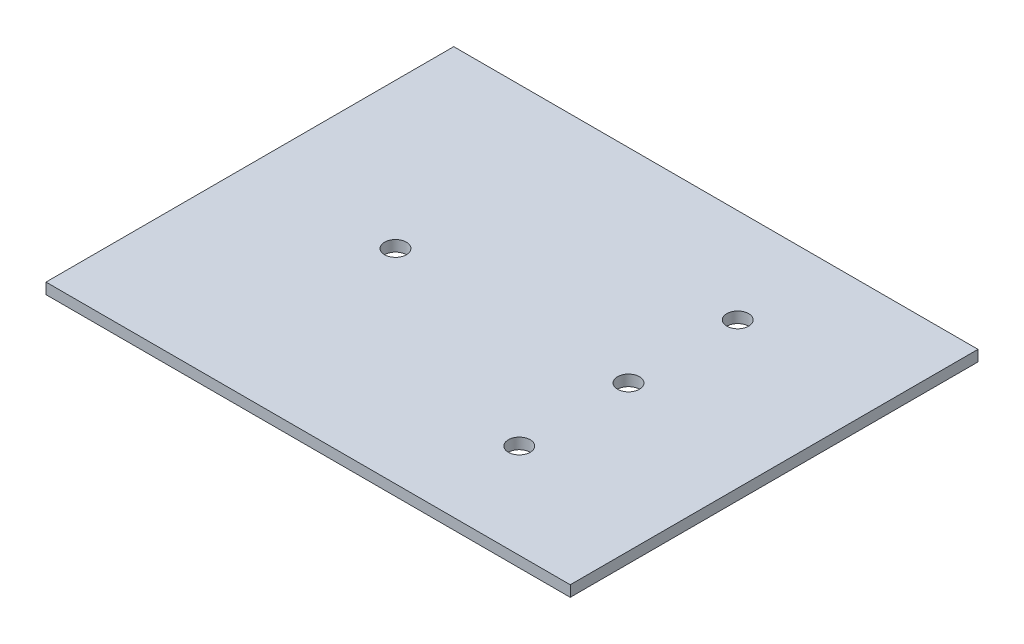
from build123d import *

# Parameters (mm, degrees)
BOSS_EXTRUDE1_DEPTH = 9.525
BOSS_EXTRUDE2_DEPTH = 9.525
SKETCH4_W           = 63.5
SKETCH4_H           = 355.6
BOSS_EXTRUDE3_DEPTH = 9.525
SKETCH5_R           = 9.525
CUT_EXTRUDE1_DEPTH  = 648.271856043


with BuildPart() as part:
    # Sketch1 → Boss-Extrude1 (new body)
    with BuildSketch(Plane(origin=(0, 0, 0), x_dir=(1, 0, 0), z_dir=(0, 1, 0))):
        Polygon((461.512355724, 17.636671785), (558.8, 99.270698215), (558.8, 177.8), (228.6, 177.8), (228.6, -177.8), align=None)
    extrude(amount=BOSS_EXTRUDE1_DEPTH)

    # Sketch1<4> → Boss-Extrude2 (add)
    with BuildSketch(Plane(origin=(0, 0, 0), x_dir=(1, 0, 0), z_dir=(0, 1, 0))):
        Polygon((558.8, -177.8), (558.8, 99.270698215), (461.512355724, 17.636671785), (228.6, -177.8), align=None)
    extrude(amount=BOSS_EXTRUDE2_DEPTH)

    # Sketch4 → Boss-Extrude3 (add)
    with BuildSketch(Plane.XZ):
        with Locations((590.55, 0)):
            Rectangle(SKETCH4_W, SKETCH4_H)
        with Locations((196.85, 0)):
            Rectangle(SKETCH4_W, SKETCH4_H)
    extrude(amount=-BOSS_EXTRUDE3_DEPTH)

    # Sketch5 → Cut-Extrude1 (cut, through all)
    with BuildSketch(Plane.XZ):
        with Locations((495.3, -95.25)):
            Circle(SKETCH5_R)
        with Locations((495.3, 95.25)):
            Circle(SKETCH5_R)
        with Locations((292.1, 0)):
            Circle(SKETCH5_R)
        with Locations((495.3, 0)):
            Circle(SKETCH5_R)
    extrude(amount=-CUT_EXTRUDE1_DEPTH, mode=Mode.SUBTRACT)


solid = part.part
